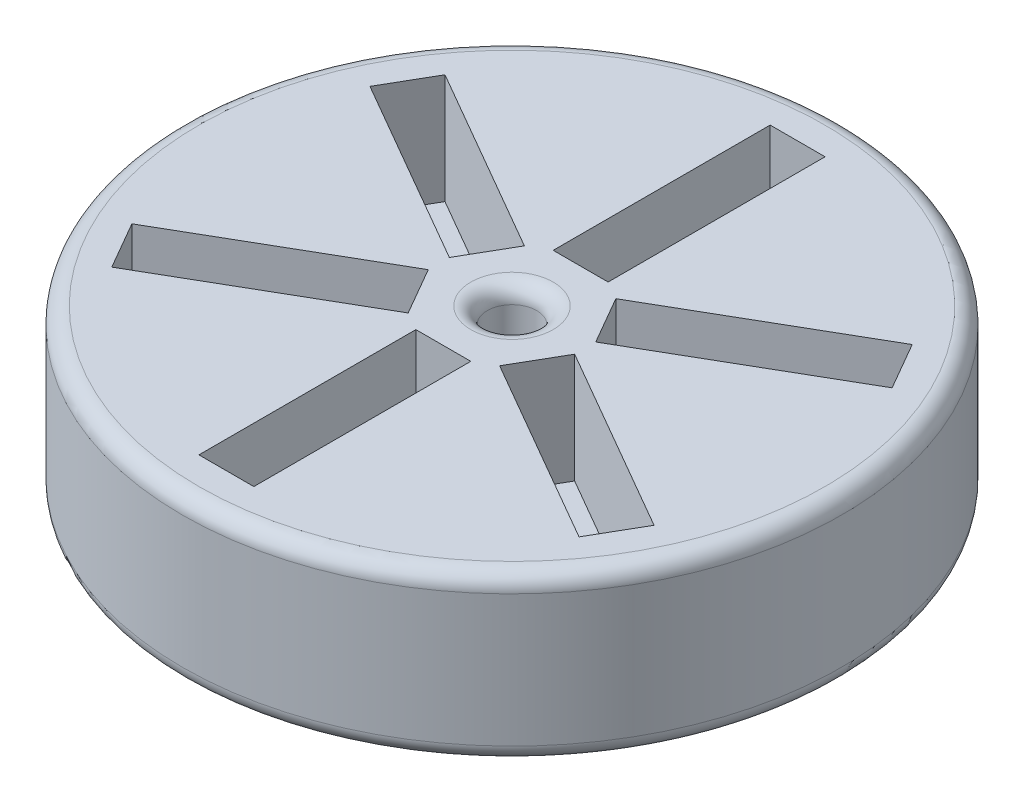
from build123d import *

# Parameters (mm, degrees)
SKETCH2_R           = 30
BOSS_EXTRUDE1_DEPTH = 15
SKETCH3_R           = 2.25
CUT_EXTRUDE1_DEPTH  = 9
FILLET1_R           = 1.5
CUT_EXTRUDE2_DEPTH  = 1
SKETCH5_W           = 5
SKETCH5_H           = 19.75
CUT_EXTRUDE3_DEPTH  = 10
CIRPATTERN1_COUNT   = 6


with BuildPart() as part:
    # Sketch2 → Boss-Extrude1 (new body)
    with BuildSketch(Plane(origin=(0, 0, 0), x_dir=(1, 0, 0), z_dir=(0, 1, 0))):
        with Locations(Location((0, 0, 0), (0, 0, 270))):
            Circle(SKETCH2_R)
    extrude(amount=BOSS_EXTRUDE1_DEPTH)

    # Sketch3 → Cut-Extrude1 (cut)
    with BuildSketch(Plane(origin=(0, 15, 0), x_dir=(1, 0, 0), z_dir=(0, 1, 0))):
        with Locations(Location((0, 0, 0), (0, 0, 270))):
            Circle(SKETCH3_R)
    extrude(amount=-CUT_EXTRUDE1_DEPTH, mode=Mode.SUBTRACT)

    # Fillet1
    fillet1_edges = [part.edges().sort_by_distance(p)[0] for p in [
        (0, 0, -30),
        (0, 15, -30),
        (0, 15, -2.25),
    ]]
    fillet(fillet1_edges, radius=FILLET1_R)

    # Sketch4 → Cut-Extrude2 (cut)
    with BuildSketch(Plane.XZ):
        Polygon((-0.5, 24.5), (-0.5, -27.5), (0.5, -27.5), (0.5, 24.5), (3, 24.5), (0, 27.5), (-3, 24.5), align=None)
    extrude(amount=-CUT_EXTRUDE2_DEPTH, mode=Mode.SUBTRACT)

    # Sketch5 → Cut-Extrude3 (cut)
    with BuildSketch(Plane(origin=(0, 15, 0), x_dir=(1, 0, 0), z_dir=(0, 1, 0))):
        with Locations((0, 16.125)):
            Rectangle(SKETCH5_W, SKETCH5_H)
    cut_extrude3 = extrude(amount=-CUT_EXTRUDE3_DEPTH, mode=Mode.SUBTRACT)

    # CirPattern1: Cut-Extrude3 ×6 about axis
    cirpattern1_axis = Axis((0, 0, 0), (0, 1, 0))
    for i in range(1, CIRPATTERN1_COUNT):
        add(cut_extrude3.rotate(cirpattern1_axis, i * 360 / CIRPATTERN1_COUNT), mode=Mode.SUBTRACT)


solid = part.part
